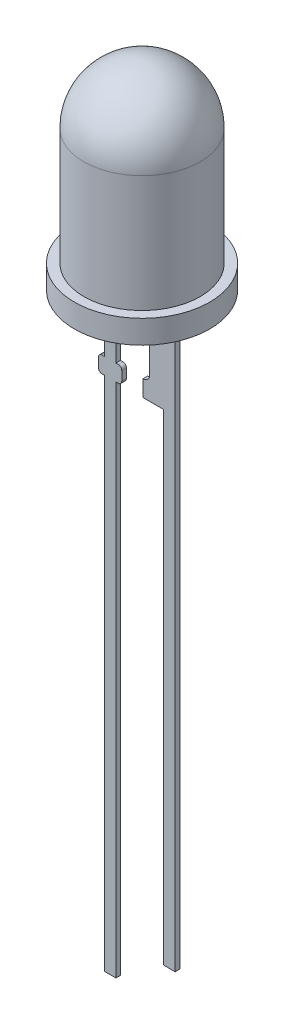
from build123d import *

# Parameters (mm, degrees)
SALIENTE_EXTRUIR1_DEPTH   = 0.1
SALIENTE_EXTRUIR1_2_DEPTH = 0.1
CROQUIS7_R                = 2.9
SALIENTE_EXTRUIR2_DEPTH   = 1


with BuildPart() as part:
    # Croquis1 → Saliente-Extruir1 (new, symmetric)
    with BuildSketch(Plane.XY):
        with BuildLine():
            Line((2.141229394, -3.596955899), (1.261229394, -3.596955899))
            Line((1.261229394, -3.596955899), (1.261229394, -2.896955899))
            Line((1.261229394, -2.896955899), (1.267504118, -2.896955899))
            ThreePointArc((1.267504118, -2.896955899), (1.465494017, -2.814945798), (1.547504118, -2.616955899))
            Line((1.547504118, -2.616955899), (1.547504118, 0.274513326))
            Line((1.547504118, 0.274513326), (1.547504118, 1.461848277))
            Line((1.547504118, 1.461848277), (0.641229394, 1.974513326))
            Line((0.641229394, 1.974513326), (0.641229394, 4.774513326))
            Line((0.641229394, 4.774513326), (2.841229394, 4.774513326))
            Line((2.841229394, 4.774513326), (2.841229394, 1.461848277))
            Line((2.841229394, 1.461848277), (2.641229394, 1.461848277))
            Line((2.641229394, 1.461848277), (2.641229394, 0.274513326))
            Line((2.641229394, 0.274513326), (2.641229394, -24.225486674))
            Line((2.641229394, -24.225486674), (2.141229394, -24.225486674))
            Line((2.141229394, -24.225486674), (2.141229394, -3.596955899))
        make_face()
    extrude(amount=SALIENTE_EXTRUIR1_DEPTH, both=True)



with BuildPart() as body_2:
    # Croquis1 → Saliente-Extruir1 2 (new, symmetric)
    with BuildSketch(Plane.XY):
        with BuildLine():
            Line((-0.398770606, 0.274513326), (-0.398770606, -2.896955899))
            Line((-0.398770606, -2.896955899), (-0.498770606, -2.896955899))
            ThreePointArc((-0.498770606, -2.896955899), (-0.604836624, -2.940889882), (-0.648770606, -3.046955899))
            Line((-0.648770606, -3.046955899), (-0.648770606, -3.446955899))
            ThreePointArc((-0.648770606, -3.446955899), (-0.604836624, -3.553021917), (-0.498770606, -3.596955899))
            Line((-0.498770606, -3.596955899), (-0.398770606, -3.596955899))
            Line((-0.398770606, -3.596955899), (-0.398770606, -25.725486674))
            Line((-0.398770606, -25.725486674), (0.101229394, -25.725486674))
            Line((0.101229394, -25.725486674), (0.101229394, -3.596955899))
            Line((0.101229394, -3.596955899), (0.201229394, -3.596955899))
            ThreePointArc((0.201229394, -3.596955899), (0.307295411, -3.553021917), (0.351229394, -3.446955899))
            Line((0.351229394, -3.446955899), (0.351229394, -3.046955899))
            ThreePointArc((0.351229394, -3.046955899), (0.307295411, -2.940889882), (0.201229394, -2.896955899))
            Line((0.201229394, -2.896955899), (0.101229394, -2.896955899))
            Line((0.101229394, -2.896955899), (0.101229394, 0.274513326))
            Line((0.101229394, 0.274513326), (0.101229394, 4.774513326))
            Line((0.101229394, 4.774513326), (-0.398770606, 4.774513326))
            Line((-0.398770606, 4.774513326), (-0.398770606, 2.056181546))
            Line((-0.398770606, 2.056181546), (-0.898770606, 0.945997951))
            Line((-0.898770606, 0.945997951), (-0.898770606, 0.274513326))
            Line((-0.898770606, 0.274513326), (-0.398770606, 0.274513326))
        make_face()
    extrude(amount=SALIENTE_EXTRUIR1_2_DEPTH, both=True)


with BuildPart() as part_1:
    add(part.part)

    add(body_2.part)  # Saliente-Extruir2 merges body 2
    # Croquis7 → Saliente-Extruir2 (add)
    with BuildSketch(Plane(origin=(0, 0.274513326, 0), x_dir=(-1, 0, 0), z_dir=(0, -1, 0))):
        with Locations(Location((-1.121229394, 0, 0), (0, 0, 90))):
            Circle(CROQUIS7_R)
    extrude(amount=-SALIENTE_EXTRUIR2_DEPTH)

    # Croquis9 → Revolución2 (revolve)
    with BuildSketch(Plane.XY, mode=Mode.PRIVATE) as revoluci_n2_sk:
        with BuildLine():
            Line((-1.370805616, 1.274513326), (-1.370805616, 6.27937105))
            ThreePointArc((-1.370805616, 6.27937105), (-0.641386379, 8.044319707), (1.121229394, 8.779358362))
            Line((1.121229394, 8.779358362), (1.121229394, 8.681444496))
            Line((1.121229394, 8.681444496), (1.021229394, 8.676941396))
            ThreePointArc((1.021229394, 8.676941396), (-0.605613383, 7.937816712), (-1.270805616, 6.27937105))
            Line((-1.270805616, 6.27937105), (-1.270805616, 1.274513326))
            Line((-1.270805616, 1.274513326), (-1.370805616, 1.274513326))
        make_face()
    revolve(revoluci_n2_sk.sketch.rotate(Axis((1.121229394, 8.681444496, 0), (0, -1, 0)), 270), axis=Axis((1.121229394, 8.681444496, 0), (0, -1, 0)))


solid = part_1.part
